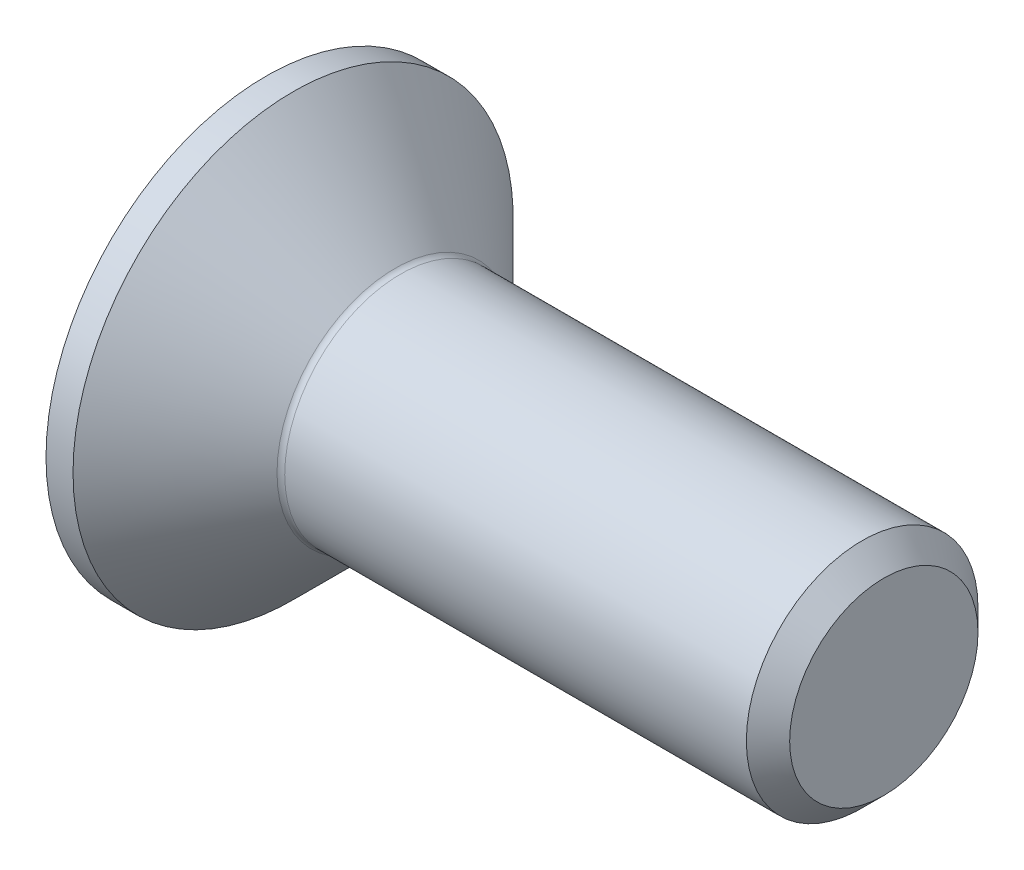
from build123d import *

# Parameters (mm, degrees)
FILLET1_R   = 0.1
HEX_2_DEPTH = 1.2


with BuildPart() as part:
    # BodySke → BaseBody (revolve)
    with BuildSketch(Plane.XY, mode=Mode.PRIVATE) as basebody_sk:
        Polygon((0, 0), (0, 2.85), (0.35, 2.85), (1.7, 1.5), (7.7195, 1.5), (8, 1.2195), (8, 0), align=None)
    revolve(basebody_sk.sketch.rotate(Axis((0, 0, 0), (1, 0, 0)), 90), axis=Axis((0, 0, 0), (1, 0, 0)))

    # Fillet1
    fillet1_edges = [part.edges().sort_by_distance(p)[0] for p in [
        (1.7, 0, -1.5),
    ]]
    fillet(fillet1_edges, radius=FILLET1_R)

    # Sketch2 → PreBroach (revolve, cut)
    with BuildSketch(Plane.XY, mode=Mode.PRIVATE) as prebroach_sk:
        Polygon((0, 1.01), (1.2, 1.01), (1.783123772, 0), (0, 0), align=None)
    revolve(prebroach_sk.sketch.rotate(Axis((0, 0, 0), (1, 0, 0)), 90), axis=Axis((0, 0, 0), (1, 0, 0)), mode=Mode.SUBTRACT)

    # Sketch3 → Hex 2 (cut)
    with BuildSketch(Plane.ZY):
        Polygon((-1.01, -0.583123772), (-1.01, 0.583123772), (0, 1.166247544), (1.01, 0.583123772), (1.01, -0.583123772), (0, -1.166247544), align=None)
    extrude(amount=-HEX_2_DEPTH, mode=Mode.SUBTRACT)


solid = part.part
